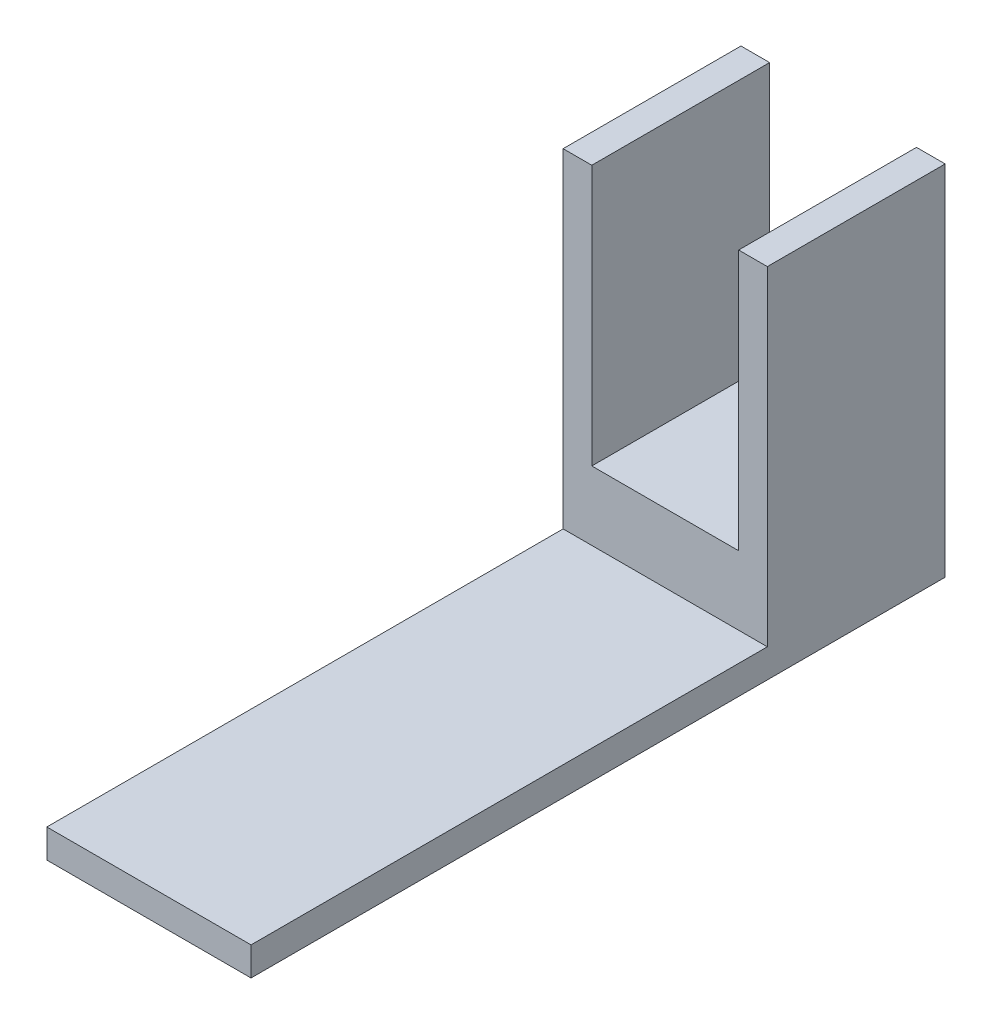
from build123d import *

# Parameters (mm, degrees)
BOSS_EXTRUDE1_DEPTH      = 2
BOSS_EXTRUDE1_DEPTH_BACK = 4
SKETCH1_W                = 12.8
SKETCH1_H                = 15.5
SKETCH2_W                = 15.5
SKETCH2_H                = 4
SKETCH2_H_2              = 22.7
SKETCH2_H_3              = 2
BOSS_EXTRUDE2_DEPTH      = 2.5
BOSS_EXTRUDE3_DEPTH      = 2.5
SKETCH5_W                = 17.8
SKETCH5_H                = 60.5
BOSS_EXTRUDE5_DEPTH      = 2.5


with BuildPart() as part:
    # Sketch1 → Boss-Extrude1 (new, two sides: drawn at the far end of the back side and taken through both)
    with BuildSketch(Plane(origin=(0, 0, 0), x_dir=(1, 0, 0), z_dir=(0, 1, 0)).offset(-BOSS_EXTRUDE1_DEPTH_BACK)):
        with Locations((6.4, 7.75)):
            Rectangle(SKETCH1_W, SKETCH1_H)
    extrude(amount=BOSS_EXTRUDE1_DEPTH + BOSS_EXTRUDE1_DEPTH_BACK)

    # Sketch2 → Boss-Extrude2 (add)
    with BuildSketch(Plane(origin=(12.8, 0, 0), x_dir=(0, 0, -1), z_dir=(1, 0, 0))):
        with Locations((7.75, -2)):
            Rectangle(SKETCH2_W, SKETCH2_H)
        with Locations((7.75, 13.35)):
            Rectangle(SKETCH2_W, SKETCH2_H_2)
        with Locations((7.75, 1)):
            Rectangle(SKETCH2_W, SKETCH2_H_3)
    extrude(amount=BOSS_EXTRUDE2_DEPTH)

    # Sketch3 → Boss-Extrude3 (add)
    with BuildSketch(Plane.ZY):
        Polygon((0, 0), (0, 24.7), (-15.5, 24.7), (-15.5, 0), (-15.5, -4), (0, -4), align=None)
    extrude(amount=BOSS_EXTRUDE3_DEPTH)

    # Sketch5 → Boss-Extrude5 (add)
    with BuildSketch(Plane.XZ.offset(4)):
        with Locations((6.4, 14.75)):
            Rectangle(SKETCH5_W, SKETCH5_H)
    extrude(amount=BOSS_EXTRUDE5_DEPTH)


solid = part.part
